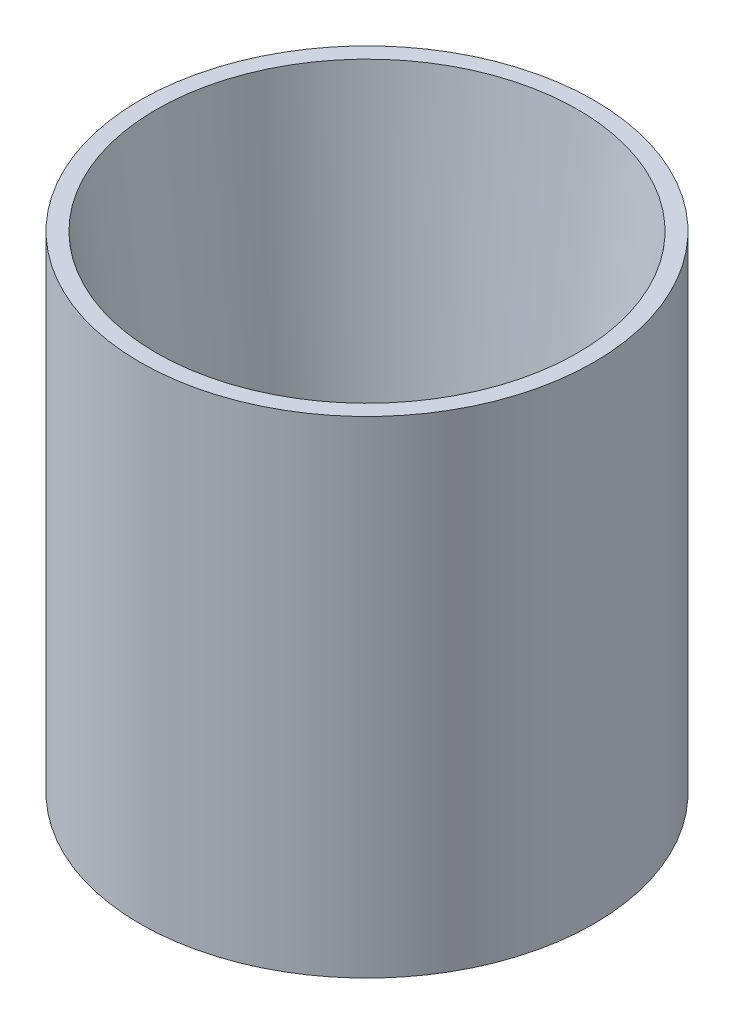
from build123d import *


with BuildPart() as part:
    # Sketch1 → Revolve1 (revolve)
    with BuildSketch(Plane.XY, mode=Mode.PRIVATE) as revolve1_sk:
        Polygon((-19.71519884, -16.64516129), (-21.79709695, -16.64516129), (-21.79709695, -3.14516129), (-21.79709695, -1.64516129), (-21.29709695, -1.64516129), (-19.71519884, -16.14516129), align=None)
    revolve(revolve1_sk.sketch.rotate(Axis((-14.79709695, 26.42483871, 0), (0, -1, 0)), 270), axis=Axis((-14.79709695, 26.42483871, 0), (0, -1, 0)))


solid = part.part
